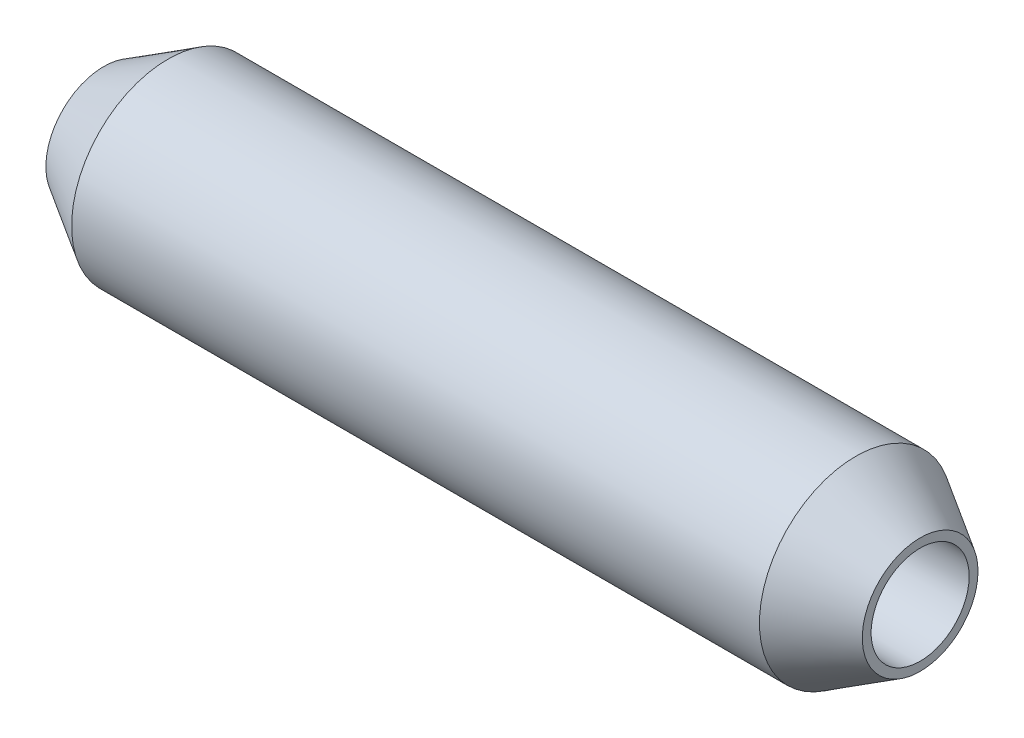
from build123d import *

# Parameters (mm, degrees)
SKETCH1_R           = 3
SKETCH1_R_2         = 1.525
BOSS_EXTRUDE1_DEPTH = 25.4
CHAMFER1_SIZE       = 2
CHAMFER1_SIZE2      = 1.2


with BuildPart() as part:
    # Sketch1 → Boss-Extrude1 (new body)
    with BuildSketch(Plane(origin=(0, 0, 0), x_dir=(0, 0, -1), z_dir=(1, 0, 0))):
        Circle(SKETCH1_R)
        Circle(SKETCH1_R_2, mode=Mode.SUBTRACT)
    extrude(amount=BOSS_EXTRUDE1_DEPTH)

    # Chamfer1
    chamfer1_edges = [part.edges().sort_by_distance(p)[0] for p in [
        (0, 0, 3),
        (25.4, 0, 3),
    ]]
    chamfer1_side = [part.faces().sort_by_distance(p)[0] for p in [
        (12.7, 0, 3),
    ]]
    chamfer(chamfer1_edges, length=CHAMFER1_SIZE, length2=CHAMFER1_SIZE2, reference=chamfer1_side[0])


solid = part.part
